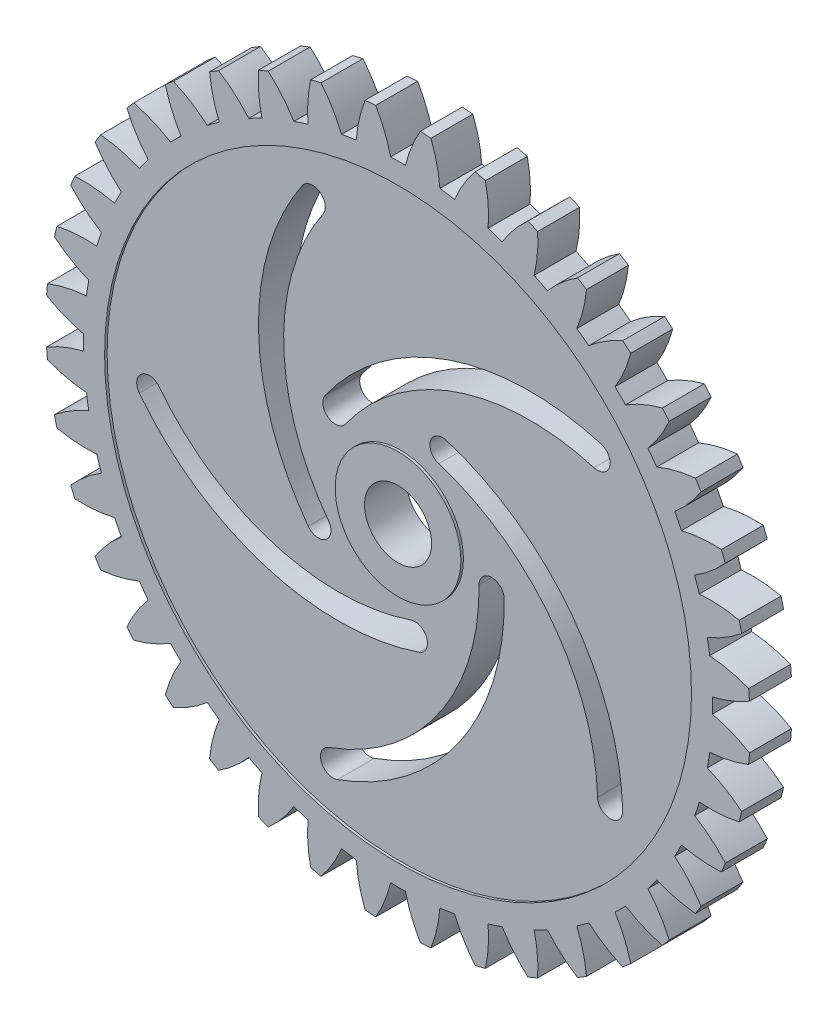
from build123d import *

# Parameters (mm, degrees)
SKETCH1_R           = 42
BOSS_EXTRUDE1_DEPTH = 2.5
CUT_EXTRUDE1_DEPTH  = 60.607046563
CIRPATTERN1_COUNT   = 40
SKETCH3_R           = 4
CUT_EXTRUDE2_DEPTH  = 60.487870531
SKETCH4_R           = 35
SKETCH4_R_2         = 7.5
CUT_EXTRUDE3_DEPTH  = 0.3
CUT_EXTRUDE4_DEPTH  = 60.463406734


with BuildPart() as part:
    # Sketch1 → Boss-Extrude1 (new, symmetric)
    with BuildSketch(Plane.XY):
        Circle(SKETCH1_R)
    extrude(amount=BOSS_EXTRUDE1_DEPTH, both=True)

    # Sketch2 → Cut-Extrude1 (cut, through all)
    with BuildSketch(Plane.XY.offset(2.5)):
        with BuildLine():
            ThreePointArc((0.884917851, 37.489557485), (0, 37.5), (-0.884917851, 37.489557485))
            ThreePointArc((-0.884917851, 37.489557485), (-1.613805177, 39.782164348), (-2.67818386, 41.93957506))
            ThreePointArc((-2.67818386, 41.93957506), (0, 42.025), (2.67818386, 41.93957506))
            ThreePointArc((2.67818386, 41.93957506), (1.613805177, 39.782164348), (0.884917851, 37.489557485))
        make_face()
    cut_extrude1 = extrude(amount=-CUT_EXTRUDE1_DEPTH, mode=Mode.SUBTRACT)

    # CirPattern1: Cut-Extrude1 ×40 about axis
    cirpattern1_axis = Axis((0, 0, 0), (0, 0, 1))
    for i in range(1, CIRPATTERN1_COUNT):
        add(cut_extrude1.rotate(cirpattern1_axis, i * 360 / CIRPATTERN1_COUNT), mode=Mode.SUBTRACT)

    # Sketch3 → Cut-Extrude2 (cut, through all)
    with BuildSketch(Plane.XY.offset(2.5)):
        Circle(SKETCH3_R)
    extrude(amount=-CUT_EXTRUDE2_DEPTH, mode=Mode.SUBTRACT)

    # Sketch4 → Cut-Extrude3 (cut)
    with BuildSketch(Plane.XY.offset(2.5)):
        Circle(SKETCH4_R)
        Circle(SKETCH4_R_2, mode=Mode.SUBTRACT)
    cut_extrude3 = extrude(amount=-CUT_EXTRUDE3_DEPTH, mode=Mode.SUBTRACT)

    # Mirror1: Cut-Extrude3 across plane
    add(cut_extrude3.mirror(Plane.XY), mode=Mode.SUBTRACT)

    # Sketch5 → Cut-Extrude4 (cut, through all)
    with BuildSketch(Plane.XY.offset(2.2)):
        with BuildLine():
            ThreePointArc((26.499370502, -16.539671718), (20.418472515, 0.715264432), (5.446738923, 11.229889254))
            ThreePointArc((5.446738923, 11.229889254), (3.568069717, 10.244697895), (4.553261077, 8.366028689))
            ThreePointArc((4.553261077, 8.366028689), (18.027821309, -1.097133651), (23.500629498, -16.626576186))
            ThreePointArc((23.500629498, -16.626576186), (25.043452234, -18.082494454), (26.499370502, -16.539671718))
        make_face()
        with BuildLine():
            ThreePointArc((-7.541406739, -30.313438636), (6.989911905, -19.198092473), (12.363394243, -1.709929921))
            ThreePointArc((12.363394243, -1.709929921), (10.84588087, -0.227650204), (9.363601152, -1.745163577))
            ThreePointArc((9.363601152, -1.745163577), (4.527467048, -17.484509873), (-8.550719732, -27.48832142))
            ThreePointArc((-8.550719732, -27.48832142), (-9.458621843, -29.405536525), (-7.541406739, -30.313438636))
        make_face()
        with BuildLine():
            ThreePointArc((-31.16021619, -2.195063675), (-16.098469379, -12.580338099), (2.194258935, -12.286684064))
            ThreePointArc((2.194258935, -12.286684064), (3.135053298, -10.385393458), (1.233762693, -9.444599095))
            ThreePointArc((1.233762693, -9.444599095), (-15.22969279, -9.708887727), (-28.78526492, -0.362140746))
            ThreePointArc((-28.78526492, -0.362140746), (-30.88920202, -0.091126576), (-31.16021619, -2.195063675))
        make_face()
        with BuildLine():
            ThreePointArc((-11.716665963, 28.956814677), (-16.939313148, 11.423015937), (-11.007267641, -5.883658439))
            ThreePointArc((-11.007267641, -5.883658439), (-8.908311375, -6.19087594), (-8.601093874, -4.091919674))
            ThreePointArc((-8.601093874, -4.091919674), (-13.93993483, 11.484087265), (-9.239552364, 27.264506131))
            ThreePointArc((-9.239552364, 27.264506131), (-9.63195489, 29.349217204), (-11.716665963, 28.956814677))
        make_face()
        with BuildLine():
            ThreePointArc((23.91891839, 20.091359352), (5.629398107, 19.640150203), (-8.997124461, 8.65038317))
            ThreePointArc((-8.997124461, 8.65038317), (-8.64069251, 6.559221707), (-6.549531047, 6.915653657))
            ThreePointArc((-6.549531047, 6.915653657), (6.614339264, 16.806443987), (23.074907518, 17.212532221))
            ThreePointArc((23.074907518, 17.212532221), (24.93632652, 18.229940351), (23.91891839, 20.091359352))
        make_face()
    extrude(amount=-CUT_EXTRUDE4_DEPTH, mode=Mode.SUBTRACT)


solid = part.part
